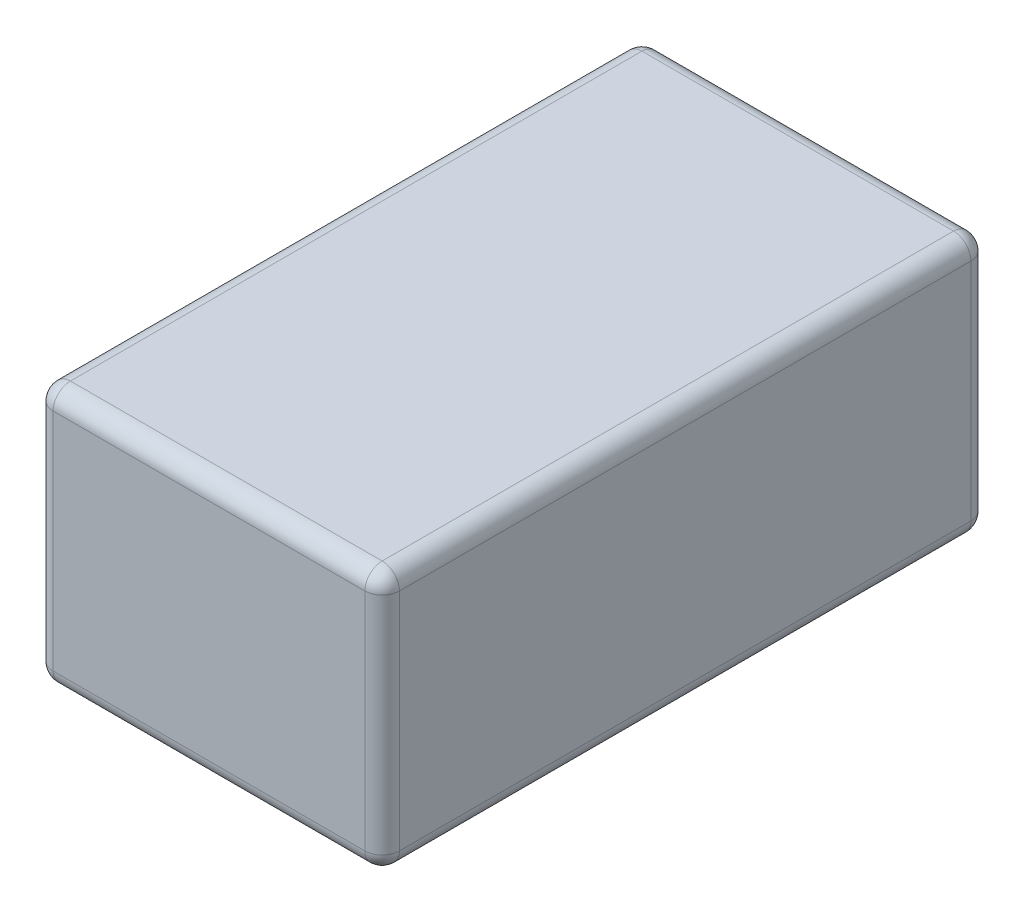
from build123d import *

# Parameters (mm, degrees)
SKICA1_W                = 20
SKICA1_H                = 35
P_IDAT_VYSUNUT_M1_DEPTH = 7.5
ZAOBLIT1_R              = 1


with BuildPart() as part:
    # Skica1 → Přidat vysunutím1 (new, symmetric)
    with BuildSketch(Plane(origin=(0, 0, 0), x_dir=(1, 0, 0), z_dir=(0, 1, 0))):
        Rectangle(SKICA1_W, SKICA1_H)
    extrude(amount=P_IDAT_VYSUNUT_M1_DEPTH, both=True)

    # Zaoblit1
    zaoblit1_edges = [part.edges().sort_by_distance(p)[0] for p in [
        (10, 7.5, 0),
        (0, 7.5, -17.5),
        (-10, 7.5, 0),
        (0, -7.5, -17.5),
        (10, -7.5, 0),
        (0, -7.5, 17.5),
        (-10, -7.5, 0),
        (0, 7.5, 17.5),
        (-10, 0, -17.5),
        (10, 0, -17.5),
        (10, 0, 17.5),
        (-10, 0, 17.5),
    ]]
    fillet(zaoblit1_edges, radius=ZAOBLIT1_R)


solid = part.part
